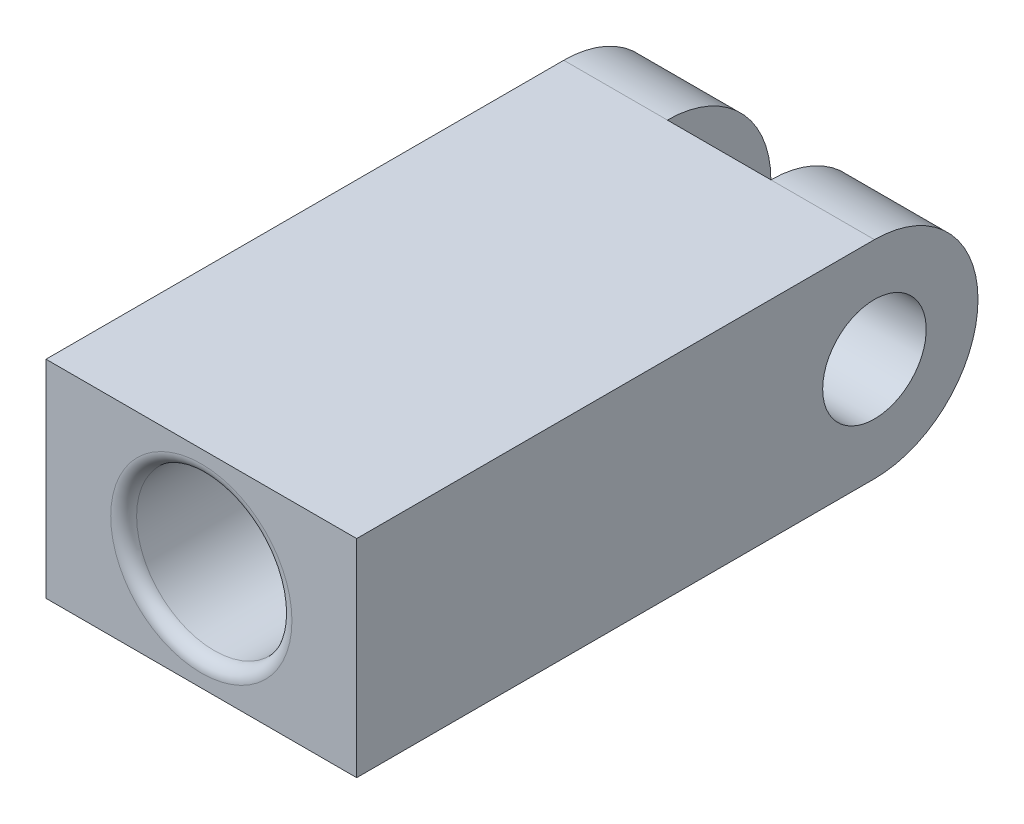
from build123d import *

# Parameters (mm, degrees)
SKETCH_1_W               = 60
SKETCH_1_H               = 40
EXTRUDE_1_DEPTH          = 100
SKETCH_6_R               = 20
EXTRUDE_2_DEPTH          = 20
EXTRUDE_START            = -20
SKETCH_7_R               = 20
EXTRUDE_3_DEPTH          = 20
CUT_EXTRUDE_1_DEPTH      = 120.268604419
CUT_EXTRUDE_1_DEPTH_BACK = 120.268604419
SKETCH_8_R               = 10
SKETCH_9_R               = 20
CUT_EXTRUDE_2_DEPTH      = 20
SKETCH_10_R              = 15
CUT_EXTRUDE_3_DEPTH      = 30
FILLET_2_R               = 2.5


with BuildPart() as part:
    # 스케치1 → 보스-돌출1 (new body)
    with BuildSketch(Plane.XY):
        with Locations((20, 5)):
            Rectangle(SKETCH_1_W, SKETCH_1_H)
    extrude(amount=EXTRUDE_1_DEPTH)

    # 스케치6 → 보스-돌출2 (add)
    with BuildSketch(Plane(origin=(50, 0, 0), x_dir=(0, 0, -1), z_dir=(1, 0, 0))):
        with Locations((0, 5)):
            Circle(SKETCH_6_R)
    extrude(amount=-EXTRUDE_2_DEPTH)

    # 스케치7 → 보스-돌출3 (add)
    with BuildSketch(Plane.ZY.offset(10).offset(EXTRUDE_START)):
        with Locations((0, 5)):
            Circle(SKETCH_7_R)
    extrude(amount=EXTRUDE_3_DEPTH)

    # 스케치8 → 컷-돌출1 (cut, two sides: drawn at the far end of the back side and taken through both)
    with BuildSketch(Plane.ZY.offset(10).offset(-CUT_EXTRUDE_1_DEPTH_BACK)):
        with Locations((0, 5)):
            Circle(SKETCH_8_R)
    extrude(amount=CUT_EXTRUDE_1_DEPTH + CUT_EXTRUDE_1_DEPTH_BACK, mode=Mode.SUBTRACT)

    # 스케치9 → 컷-돌출2 (cut)
    with BuildSketch(Plane.ZY.offset(-30)):
        with Locations((0, 5)):
            Circle(SKETCH_9_R)
    extrude(amount=CUT_EXTRUDE_2_DEPTH, mode=Mode.SUBTRACT)

    # 스케치10 → 컷-돌출3 (cut)
    with BuildSketch(Plane.XY.offset(100)):
        with Locations((20, 5)):
            Circle(SKETCH_10_R)
    extrude(amount=-CUT_EXTRUDE_3_DEPTH, mode=Mode.SUBTRACT)

    # 필렛2
    fillet_2_edges = [part.edges().sort_by_distance(p)[0] for p in [
        (5, 5, 100),
    ]]
    fillet(fillet_2_edges, radius=FILLET_2_R)


solid = part.part
